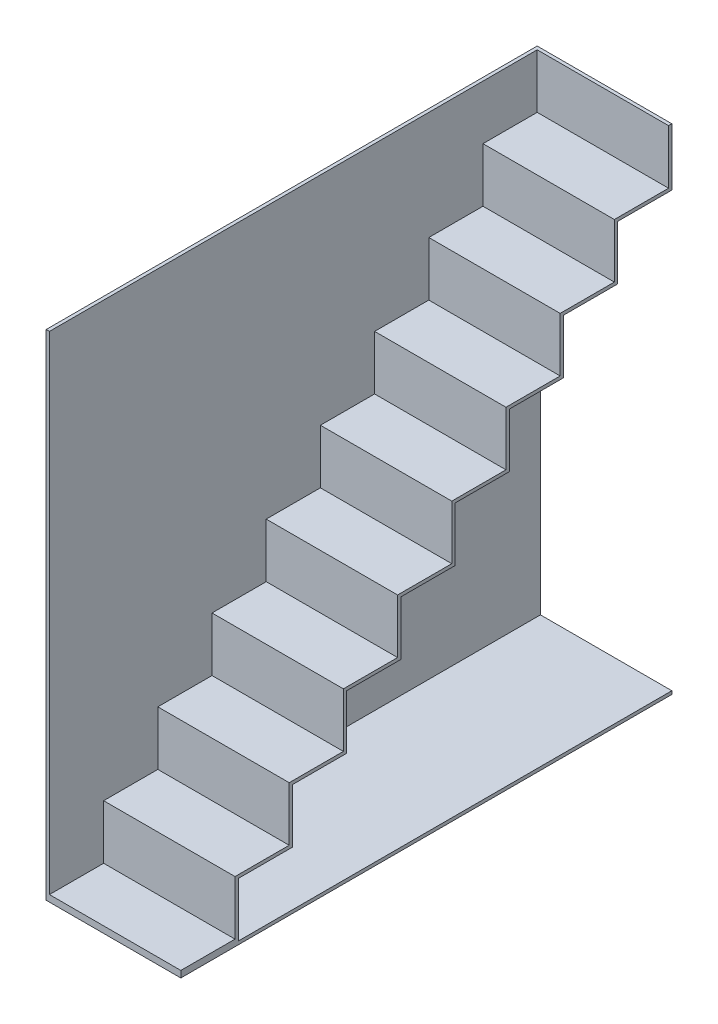
from build123d import *

# Parameters (mm, degrees)
BOSS_EXTRUDE1_DEPTH = 80
SKETCH3_W           = 299
SKETCH3_H           = 299
BOSS_EXTRUDE2_DEPTH = 2
SKETCH4_W           = 82
SKETCH4_H           = 299
BOSS_EXTRUDE3_DEPTH = 2


with BuildPart() as part:
    # Sketch1 → Boss-Extrude1 (new body)
    with BuildSketch(Plane(origin=(0, 0, 0), x_dir=(0, 0, -1), z_dir=(1, 0, 0))):
        Polygon((-23.931657395, -26.597399746), (-23.931657395, 6.402600254), (9.068342605, 6.402600254), (9.068342605, 39.402600254), (42.068342605, 39.402600254), (42.068342605, 72.402600254), (75.068342605, 72.402600254), (75.068342605, 105.402600254), (108.068342605, 105.402600254), (108.068342605, 138.402600254), (141.068342605, 138.402600254), (141.068342605, 171.402600254), (174.068342605, 171.402600254), (174.068342605, 204.402600254), (207.068342605, 204.402600254), (207.068342605, 237.402600254), (240.068342605, 237.402600254), (240.068342605, 272.402600254), (238.068342605, 272.402600254), (238.068342605, 239.402600254), (205.068342605, 239.402600254), (205.068342605, 206.402600254), (172.068342605, 206.402600254), (172.068342605, 173.402600254), (139.068342605, 173.402600254), (139.068342605, 140.402600254), (106.068342605, 140.402600254), (106.068342605, 107.402600254), (73.068342605, 107.402600254), (73.068342605, 74.402600254), (40.068342605, 74.402600254), (40.068342605, 41.402600254), (7.068342605, 41.402600254), (7.068342605, 8.402600254), (-25.931657395, 8.402600254), (-25.931657395, -24.597399746), (-58.931657395, -24.597399746), (-58.931657395, -26.597399746), align=None)
    extrude(amount=BOSS_EXTRUDE1_DEPTH)

    # Sketch3 → Boss-Extrude2 (add)
    with BuildSketch(Plane.ZY):
        with Locations((-90.568342605, 122.902600254)):
            Rectangle(SKETCH3_W, SKETCH3_H)
    extrude(amount=BOSS_EXTRUDE2_DEPTH)

    # Sketch4 → Boss-Extrude3 (add)
    with BuildSketch(Plane.XZ.offset(26.597399746)):
        with Locations((39, -90.568342605)):
            Rectangle(SKETCH4_W, SKETCH4_H)
    extrude(amount=BOSS_EXTRUDE3_DEPTH)


solid = part.part
